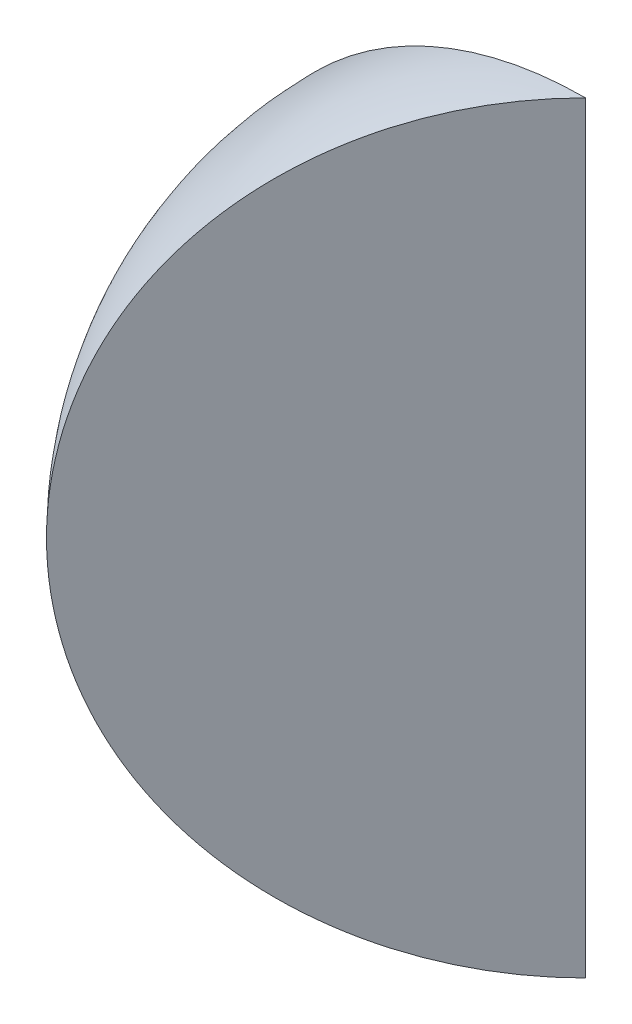
from build123d import *

# Parameters (mm, degrees)
CUT_EXTRUDE1_DEPTH      = 51.229473419
CUT_EXTRUDE1_DEPTH_BACK = 51.229473419


with BuildPart() as part:
    # Sketch1 → Revolve1 (revolve)
    with BuildSketch(Plane(origin=(0, 0, 0), x_dir=(1, 0, 0), z_dir=(0, 1, 0))):
        with BuildLine():
            Line((-29, 0), (0, 0))
            Line((0, 0), (29, 0))
            ThreePointArc((29, 0), (0, 29), (-29, 0))
        make_face()
    revolve(axis=Axis((0, 0, 0), (1, 0, 0)))

    # Sketch2 → Cut-Extrude1 (cut, two sides: drawn at the far end of the back side and taken through both)
    with BuildSketch(Plane(origin=(0, 0, 0), x_dir=(1, 0, 0), z_dir=(0, 1, 0)).offset(-CUT_EXTRUDE1_DEPTH_BACK)):
        with BuildLine():
            Line((0, 0), (-31, 0))
            ThreePointArc((-31, 0), (28.640265508, 11.863186403), (-21.920310217, -21.920310217))
            Line((-21.920310217, -21.920310217), (0, 0))
        make_face()
    extrude(amount=CUT_EXTRUDE1_DEPTH + CUT_EXTRUDE1_DEPTH_BACK, mode=Mode.SUBTRACT)


solid = part.part
